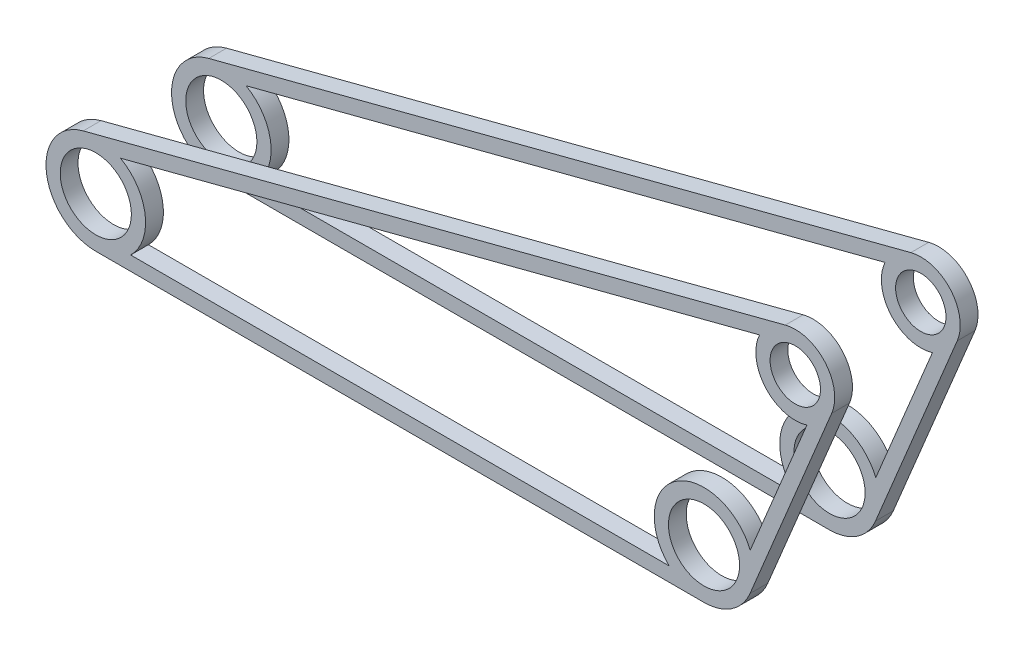
from build123d import *

# Parameters (mm, degrees)
BOSS_EXTRUDE1_START = 9.61771
SKETCH1_R           = 6.35
SKETCH1_R_2         = 4.5
BOSS_EXTRUDE1_DEPTH = 3.175
BOSS_EXTRUDE2_START = -9.61771
SKETCH1_4_R         = 6.35
SKETCH1_4_R_2       = 4.5
BOSS_EXTRUDE2_DEPTH = 3.175


with BuildPart() as part:
    # Sketch1 → Boss-Extrude1 (new body)
    with BuildSketch(Plane.XY.offset(BOSS_EXTRUDE1_START)):
        with BuildLine():
            ThreePointArc((-2.240939106, 8.602923452), (-8.817938804, -1.129626157), (0, -8.89))
            Line((0, -8.89), (108.585, -8.89))
            ThreePointArc((108.585, -8.89), (113.521814689, -7.3932375), (116.796258377, -3.406954044))
            Line((116.796258377, -3.406954044), (131.38026698, 31.742643294))
            ThreePointArc((131.38026698, 31.742643294), (130.188253202, 39.062333622), (123.103161211, 41.253277443))
            Line((123.103161211, 41.253277443), (-2.240939106, 8.602923452))
        make_face()
        Circle(SKETCH1_R, mode=Mode.SUBTRACT)
        with BuildLine():
            Line((4.420121426, 7.713275995), (118.50424059, 37.43056517))
            ThreePointArc((118.50424059, 37.43056517), (119.567273114, 29.81889368), (126.959354757, 27.715394219))
            Line((126.959354757, 27.715394219), (116.834555694, 3.31314516))
            ThreePointArc((116.834555694, 3.31314516), (103.648185311, 7.3932375), (102.363296053, -6.35))
            Line((102.363296053, -6.35), (6.221703947, -6.35))
            ThreePointArc((6.221703947, -6.35), (8.817938804, 1.129626157), (4.420121426, 7.713275995))
        make_face(mode=Mode.SUBTRACT)
        with Locations((124.877763158, 34.440613651)):
            Circle(SKETCH1_R_2, mode=Mode.SUBTRACT)
        with Locations((108.585, 0)):
            Circle(SKETCH1_R, mode=Mode.SUBTRACT)
    extrude(amount=BOSS_EXTRUDE1_DEPTH)


with BuildPart() as body_2:
    # Sketch1<4> → Boss-Extrude2 (new body)
    with BuildSketch(Plane.XY.offset(BOSS_EXTRUDE2_START)):
        with BuildLine():
            ThreePointArc((-2.240939106, 8.602923452), (-8.817938804, -1.129626157), (0, -8.89))
            Line((0, -8.89), (108.585, -8.89))
            ThreePointArc((108.585, -8.89), (113.521814689, -7.3932375), (116.796258377, -3.406954044))
            Line((116.796258377, -3.406954044), (131.38026698, 31.742643294))
            ThreePointArc((131.38026698, 31.742643294), (130.188253202, 39.062333622), (123.103161211, 41.253277443))
            Line((123.103161211, 41.253277443), (-2.240939106, 8.602923452))
        make_face()
        Circle(SKETCH1_4_R, mode=Mode.SUBTRACT)
        with BuildLine():
            Line((4.420121426, 7.713275995), (118.50424059, 37.43056517))
            ThreePointArc((118.50424059, 37.43056517), (119.567273114, 29.81889368), (126.959354757, 27.715394219))
            Line((126.959354757, 27.715394219), (116.834555694, 3.31314516))
            ThreePointArc((116.834555694, 3.31314516), (103.648185311, 7.3932375), (102.363296053, -6.35))
            Line((102.363296053, -6.35), (6.221703947, -6.35))
            ThreePointArc((6.221703947, -6.35), (8.817938804, 1.129626157), (4.420121426, 7.713275995))
        make_face(mode=Mode.SUBTRACT)
        with Locations((124.877763158, 34.440613651)):
            Circle(SKETCH1_4_R_2, mode=Mode.SUBTRACT)
        with Locations((108.585, 0)):
            Circle(SKETCH1_4_R, mode=Mode.SUBTRACT)
    extrude(amount=-BOSS_EXTRUDE2_DEPTH)


solid = Compound([part.part, body_2.part])
